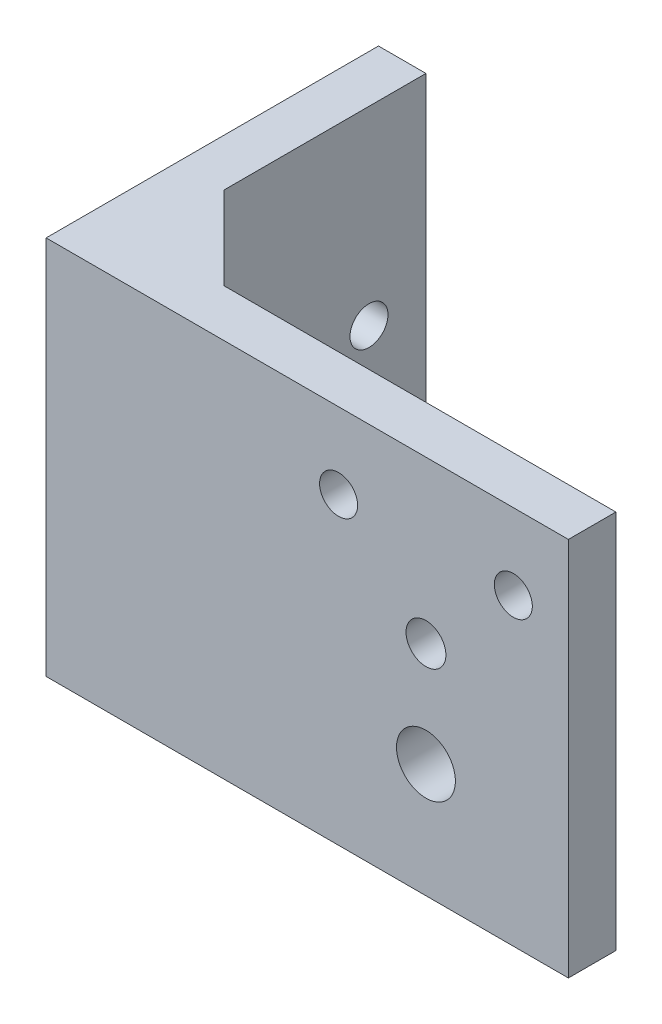
from build123d import *

# Parameters (mm, degrees)
BOSS_EXTRUDE3_DEPTH = 40
CUT_EXTRUDE1_DEPTH  = 35
BOSS_EXTRUDE4_DEPTH = 5
SKETCH7_R           = 2
SKETCH7_R_2         = 3.1
SKETCH7_R_3         = 2.1
CUT_EXTRUDE7_DEPTH  = 5
SKETCH15_R          = 2
CUT_EXTRUDE8_DEPTH  = 73.972597597


with BuildPart() as part:
    # Sketch1 → Boss-Extrude3 (new body)
    with BuildSketch(Plane(origin=(0, 0, 0), x_dir=(1, 0, 0), z_dir=(0, 1, 0))):
        Polygon((0, 0), (55, 0), (55, 5), (13.75, 5), (5, 13.75), (5, 35), (0, 35), align=None)
    extrude(amount=BOSS_EXTRUDE3_DEPTH)

    # Sketch5 → Cut-Extrude1 (cut)
    with BuildSketch(Plane.XZ):
        Polygon((5, -13.75), (5, -5), (13.75, -5), align=None)
    extrude(amount=-CUT_EXTRUDE1_DEPTH, mode=Mode.SUBTRACT)

    # Sketch6 → Boss-Extrude4 (add)
    with BuildSketch(Plane.XZ):
        Polygon((13.75, -5), (5, -13.75), (5, -5), align=None)
    extrude(amount=-BOSS_EXTRUDE4_DEPTH)

    # Sketch7 → Cut-Extrude7 (cut)
    with BuildSketch(Plane(origin=(0, 0, -5), x_dir=(-1, 0, 0), z_dir=(0, 0, -1))):
        with Locations((-49.2, 32)):
            Circle(SKETCH7_R)
        with Locations((-40, 12)):
            Circle(SKETCH7_R_2)
        with Locations((-40, 23)):
            Circle(SKETCH7_R_3)
        with Locations((-30.8, 32)):
            Circle(SKETCH7_R)
    extrude(amount=-CUT_EXTRUDE7_DEPTH, mode=Mode.SUBTRACT)

    # Sketch15 → Cut-Extrude8 (cut, through all)
    with BuildSketch(Plane(origin=(5, 0, 0), x_dir=(0, 0, -1), z_dir=(1, 0, 0))):
        with Locations((11, 31)):
            Circle(SKETCH15_R)
        with Locations((11, 9)):
            Circle(SKETCH15_R)
        with Locations((29, 20)):
            Circle(SKETCH15_R)
    extrude(amount=-CUT_EXTRUDE8_DEPTH, mode=Mode.SUBTRACT)


solid = part.part
